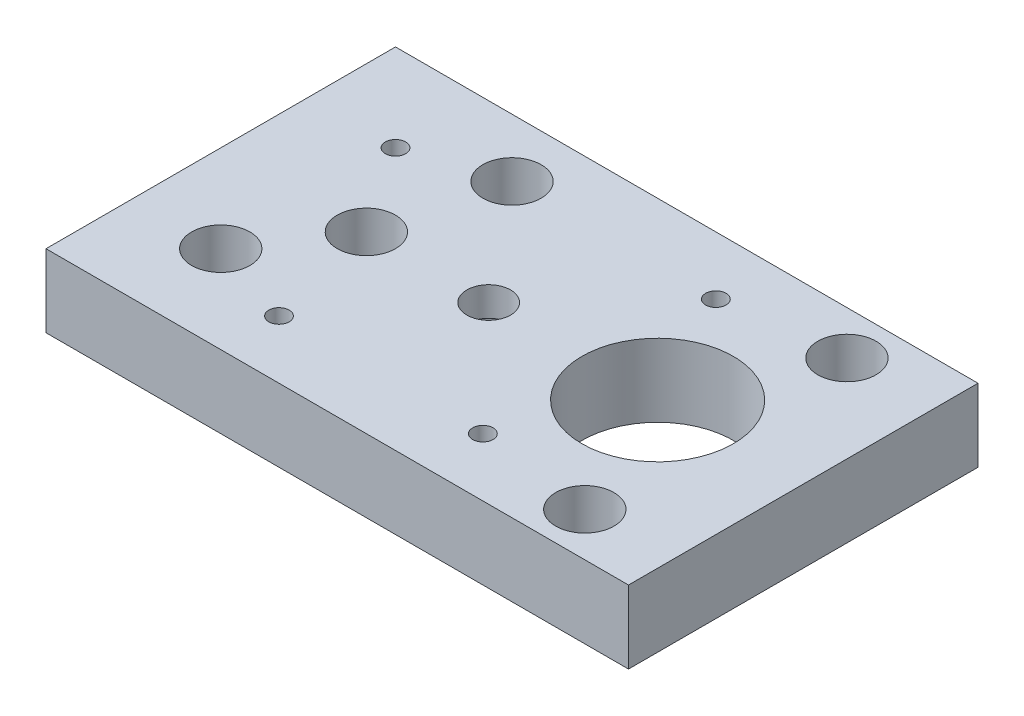
from build123d import *

# Parameters (mm, degrees)
SKETCH_1_W          = 20
SKETCH_1_H          = 12
SKETCH_1_R          = 1.6
SKETCH_1_R_2        = 2.6
SKETCH_1_R_3        = 1
EXTRUDE_1_DEPTH     = 2.5
EXTRUDE_START       = 1.5
SKETCH_1_5_R        = 1.6
SKETCH_1_5_R_2      = 0.75
EXTRUDE_2_DEPTH     = 1
SKETCH_3_R          = 0.7
SKETCH_3_R_2        = 0.35
CUT_EXTRUDE_1_DEPTH = 24.457408211
SKETCH_3_3_R        = 1
CUT_EXTRUDE_2_DEPTH = 1.5


with BuildPart() as part:
    # 草图1 → 凸台-拉伸1 (new body)
    with BuildSketch(Plane(origin=(0, 0, 0), x_dir=(1, 0, 0), z_dir=(0, 1, 0))):
        with Locations((10, -6)):
            Rectangle(SKETCH_1_W, SKETCH_1_H)
        with Locations(Location((9.2, -6, 0), (0, 0, 270))):
            Circle(SKETCH_1_R, mode=Mode.SUBTRACT)
        with Locations(Location((15, -6, 0), (0, 0, 270))):
            Circle(SKETCH_1_R_2, mode=Mode.SUBTRACT)
        with Locations(Location((5, -6, 0), (0, 0, 270))):
            Circle(SKETCH_1_R_3, mode=Mode.SUBTRACT)
    extrude(amount=EXTRUDE_1_DEPTH)

    # 草图1<5> → 凸台-拉伸2 (add)
    with BuildSketch(Plane(origin=(0, 0, 0), x_dir=(1, 0, 0), z_dir=(0, 1, 0)).offset(EXTRUDE_START)):
        with Locations(Location((9.2, -6, 0), (0, 0, 90))):
            Circle(SKETCH_1_5_R)
        with Locations(Location((9.2, -6, 0), (0, 0, 90))):
            Circle(SKETCH_1_5_R_2, mode=Mode.SUBTRACT)
    extrude(amount=EXTRUDE_2_DEPTH)

    # 草图3 → 切除-拉伸1 (cut, through all)
    with BuildSketch(Plane(origin=(0, 2.5, 0), x_dir=(1, 0, 0), z_dir=(0, 1, 0))):
        with Locations(Location((3, -9, 0), (0, 0, 270))):
            Circle(SKETCH_3_R)
        with Locations(Location((6, -2, 0), (0, 0, 270))):
            Circle(SKETCH_3_R)
        with Locations(Location((17, -1.5, 0), (0, 0, 270))):
            Circle(SKETCH_3_R)
        with Locations(Location((17, -10.5, 0), (0, 0, 270))):
            Circle(SKETCH_3_R)
        with Locations(Location((3, -3, 0), (0, 0, 270))):
            Circle(SKETCH_3_R_2)
        with Locations(Location((6, -10, 0), (0, 0, 270))):
            Circle(SKETCH_3_R_2)
        with Locations(Location((13, -10, 0), (0, 0, 270))):
            Circle(SKETCH_3_R_2)
        with Locations(Location((13, -2, 0), (0, 0, 270))):
            Circle(SKETCH_3_R_2)
    extrude(amount=-CUT_EXTRUDE_1_DEPTH, mode=Mode.SUBTRACT)

    # 草图3<3> → 切除-拉伸2 (cut)
    with BuildSketch(Plane(origin=(0, 2.5, 0), x_dir=(1, 0, 0), z_dir=(0, 1, 0))):
        with Locations(Location((6, -2, 0), (0, 0, 270))):
            Circle(SKETCH_3_3_R)
        with Locations(Location((3, -9, 0), (0, 0, 270))):
            Circle(SKETCH_3_3_R)
        with Locations(Location((17, -1.5, 0), (0, 0, 270))):
            Circle(SKETCH_3_3_R)
        with Locations(Location((17, -10.5, 0), (0, 0, 270))):
            Circle(SKETCH_3_3_R)
    extrude(amount=-CUT_EXTRUDE_2_DEPTH, mode=Mode.SUBTRACT)


solid = part.part
